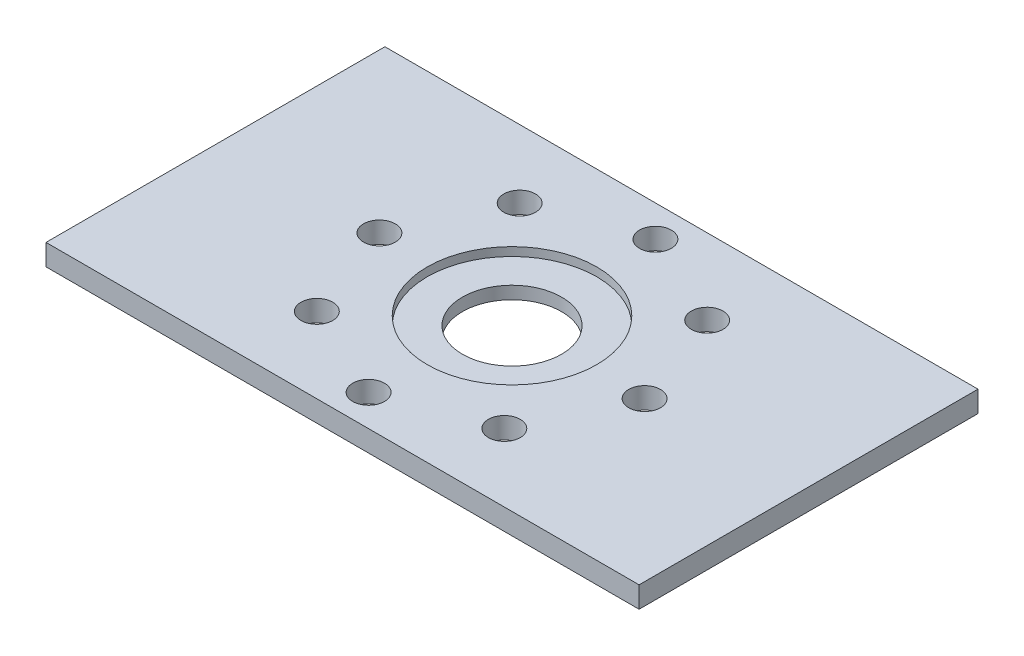
from build123d import *

# Parameters (mm, degrees)
SKETCH1_W           = 177.8
SKETCH1_H           = 101.6
BOSS_EXTRUDE1_DEPTH = 6.35
SKETCH2_R           = 14.859
CUT_EXTRUDE1_DEPTH  = 6.35
SKETCH3_R           = 25.4
CUT_EXTRUDE2_DEPTH  = 2.5654
SKETCH4_R           = 4.7625
CUT_EXTRUDE3_DEPTH  = 20.3454
CIRPATTERN1_COUNT   = 8


with BuildPart() as part:
    # Sketch1 → Boss-Extrude1 (new body)
    with BuildSketch(Plane(origin=(0, 0, 0), x_dir=(1, 0, 0), z_dir=(0, 1, 0))):
        Rectangle(SKETCH1_W, SKETCH1_H)
    extrude(amount=BOSS_EXTRUDE1_DEPTH)

    # Sketch2 → Cut-Extrude1 (cut)
    with BuildSketch(Plane(origin=(0, 6.35, 0), x_dir=(1, 0, 0), z_dir=(0, 1, 0))):
        with Locations(Location((0, 0, 0), (0, 0, 270))):
            Circle(SKETCH2_R)
    extrude(amount=-CUT_EXTRUDE1_DEPTH, mode=Mode.SUBTRACT)

    # Sketch3 → Cut-Extrude2 (cut)
    with BuildSketch(Plane(origin=(0, 6.35, 0), x_dir=(1, 0, 0), z_dir=(0, 1, 0))):
        with Locations(Location((0, 0, 0), (0, 0, 270))):
            Circle(SKETCH3_R)
    extrude(amount=-CUT_EXTRUDE2_DEPTH, mode=Mode.SUBTRACT)

    # Sketch4 → Cut-Extrude3 (cut)
    with BuildSketch(Plane(origin=(0, 6.35, 0), x_dir=(1, 0, 0), z_dir=(0, 1, 0))):
        with Locations(Location((1.623422677, 41.37015957, 0), (0, 0, 270))):
            Circle(SKETCH4_R)
    cut_extrude3 = extrude(amount=-CUT_EXTRUDE3_DEPTH, mode=Mode.SUBTRACT)

    # CirPattern1: Cut-Extrude3 ×8 about axis
    cirpattern1_axis = Axis((0, 0, 0), (0, 1, 0))
    for i in range(1, CIRPATTERN1_COUNT):
        add(cut_extrude3.rotate(cirpattern1_axis, i * 360 / CIRPATTERN1_COUNT), mode=Mode.SUBTRACT)


solid = part.part
